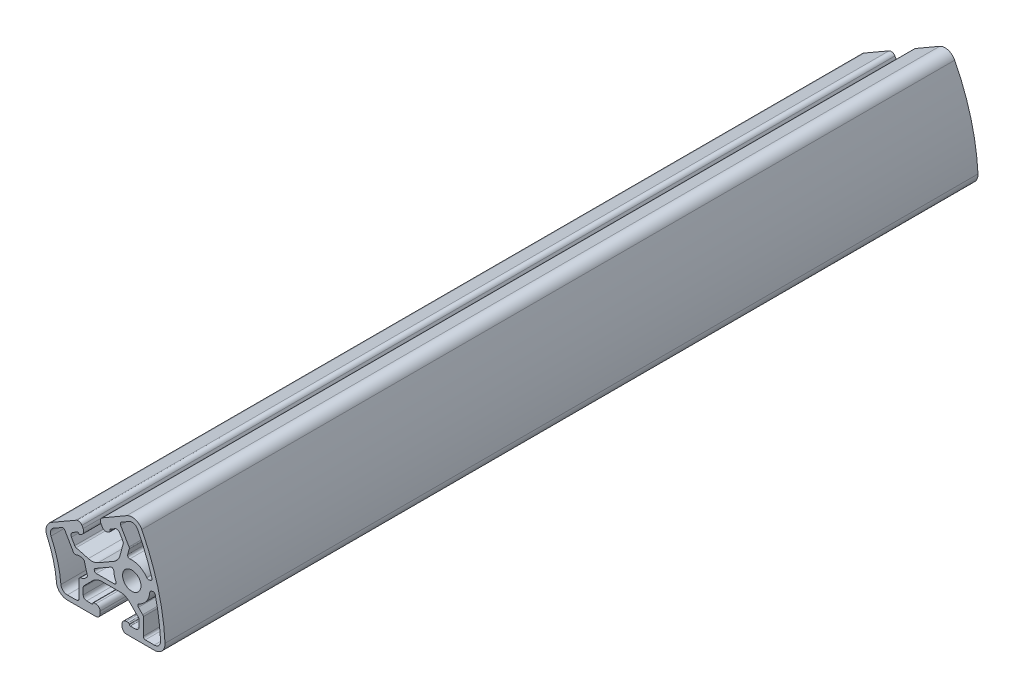
from build123d import *

# Parameters (mm, degrees)
SKETCH1_R      = 3.399999999
EXTRUDE1_DEPTH = 300


with BuildPart() as part:
    # Sketch1 → Extrude1 (new body)
    with BuildSketch(Plane.XY):
        with BuildLine():
            Line((-2.059593866, -18.104416256), (8.279174121, -18.104416256))
            ThreePointArc((8.279174121, -18.104416256), (11.181313383, -16.857158108), (12.273594224, -13.893210106))
            ThreePointArc((12.273594224, -13.893210106), (9.65925826, 2.588190449), (3.682639337, 18.16867))
            ThreePointArc((3.682639337, 18.16867), (1.25472238, 20.189383847), (-1.882233023, 19.818471458))
            Line((-1.882233023, 19.818471458), (-10.835868733, 14.649087471))
            ThreePointArc((-10.835868733, 14.649087471), (-11.517306455, 13.688428826), (-11.352775107, 12.522173349))
            Line((-11.352775107, 12.522173349), (-10.895632574, 11.730379256))
            ThreePointArc((-10.895632574, 11.730379256), (-9.971755302, 11.005610738), (-8.804122697, 11.130000122))
            Line((-8.804122697, 11.130000122), (-8.137309536, 11.51498488))
            ThreePointArc((-8.137309536, 11.51498488), (-7.962051999, 11.739304298), (-7.991807639, 12.022410299))
            Line((-7.991807639, 12.022410299), (-8.005205154, 12.04760736))
            ThreePointArc((-8.005205154, 12.04760736), (-8.034960793, 12.33071336), (-7.859703256, 12.555032779))
            Line((-7.859703256, 12.555032779), (-6.204847981, 13.510463917))
            ThreePointArc((-6.204847981, 13.510463917), (-5.241268241, 13.637321596), (-4.470212547, 13.045669753))
            Line((-4.470212547, 13.045669753), (-3.250166277, 10.932487626))
            ThreePointArc((-3.250166277, 10.932487626), (-3.138682315, 10.604066463), (-3.161365902, 10.257981807))
            Line((-3.161365902, 10.257981807), (-4.364267951, 5.768690249))
            ThreePointArc((-4.364267951, 5.768690249), (-5.183850297, 4.106741659), (-6.577045843, 2.884941957))
            Line((-6.577045843, 2.884941957), (-12.432727244, -0.495837277))
            ThreePointArc((-12.432727244, -0.495837277), (-14.187434599, -1.091480161), (-16.036515473, -0.970284996))
            Line((-16.036515473, -0.970284996), (-20.52580703, 0.232617053))
            ThreePointArc((-20.52580703, 0.232617053), (-20.836866927, 0.386014818), (-21.065546016, 0.646773342))
            Line((-21.065546016, 0.646773342), (-22.285592286, 2.75995547))
            ThreePointArc((-22.285592286, 2.75995547), (-22.412449965, 3.72353521), (-21.820798122, 4.494590904))
            Line((-21.820798122, 4.494590904), (-20.165942847, 5.450022043))
            ThreePointArc((-20.165942847, 5.450022043), (-19.884047763, 5.489639813), (-19.653748594, 5.322317672))
            Line((-19.653748594, 5.322317672), (-19.638626056, 5.298116553))
            ThreePointArc((-19.638626056, 5.298116553), (-19.408326887, 5.130794413), (-19.126431804, 5.170412183))
            Line((-19.126431804, 5.170412183), (-18.514604376, 5.523650914))
            ThreePointArc((-18.514604376, 5.523650914), (-17.78095609, 6.479759973), (-17.938259613, 7.674598851))
            Line((-17.938259613, 7.674598851), (-18.39540247, 8.466393505))
            ThreePointArc((-18.39540247, 8.466393505), (-19.35151153, 9.200041791), (-20.546350407, 9.042738268))
            Line((-20.546350407, 9.042738268), (-29.662040307, 3.779792251))
            ThreePointArc((-29.662040307, 3.779792251), (-31.47445664, 1.526261453), (-31.294110083, -1.360038798))
            ThreePointArc((-31.294110083, -1.360038798), (-28.977774789, -7.764571351), (-27.781513715, -14.469226888))
            ThreePointArc((-27.781513715, -14.469226888), (-26.49454829, -17.059009504), (-23.798184307, -18.104416256))
            Line((-23.798184307, -18.104416256), (-13.272292278, -18.104416256))
            ThreePointArc((-13.272292278, -18.104416256), (-12.158879696, -17.643225664), (-11.697689104, -16.529813082))
            Line((-11.697689104, -16.529813082), (-11.697689104, -15.615527367))
            ThreePointArc((-11.697689104, -15.615527367), (-12.158879696, -14.502114785), (-13.272292278, -14.040924193))
            Line((-13.272292278, -14.040924193), (-13.978769739, -14.040924193))
            ThreePointArc((-13.978769739, -14.040924193), (-14.242706928, -14.147561739), (-14.358490788, -14.407616548))
            Line((-14.358490788, -14.407616548), (-14.35948673, -14.4361366))
            ThreePointArc((-14.35948673, -14.4361366), (-14.475270591, -14.696191409), (-14.739207779, -14.802828955))
            Line((-14.739207779, -14.802828955), (-16.650070056, -14.802828955))
            ThreePointArc((-16.650070056, -14.802828955), (-17.547983429, -14.430901058), (-17.919911326, -13.532987685))
            Line((-17.919911326, -13.532987685), (-17.919911326, -11.092895145))
            ThreePointArc((-17.919911326, -11.092895145), (-17.852248688, -10.752732094), (-17.659561798, -10.464355784))
            Line((-17.659561798, -10.464355784), (-14.373172288, -7.177966273))
            ThreePointArc((-14.373172288, -7.177966273), (-12.83241886, -6.148467746), (-11.014976273, -5.786955939))
            Line((-11.014976273, -5.786955939), (-4.253417808, -5.786955939))
            ThreePointArc((-4.253417808, -5.786955939), (-2.435975221, -6.148467746), (-0.895221793, -7.177966273))
            Line((-0.895221793, -7.177966273), (2.391167718, -10.464355784))
            ThreePointArc((2.391167718, -10.464355784), (2.583854608, -10.752732094), (2.651517245, -11.092895145))
            Line((2.651517245, -11.092895145), (2.651517245, -13.532987685))
            ThreePointArc((2.651517245, -13.532987685), (2.279589349, -14.430901058), (1.381675976, -14.802828955))
            Line((1.381675976, -14.802828955), (-0.529186301, -14.802828955))
            ThreePointArc((-0.529186301, -14.802828955), (-0.79312349, -14.696191409), (-0.90890735, -14.4361366))
            Line((-0.90890735, -14.4361366), (-0.909903292, -14.407616548))
            ThreePointArc((-0.909903292, -14.407616548), (-1.025687153, -14.147561739), (-1.289624342, -14.040924193))
            Line((-1.289624342, -14.040924193), (-2.059593866, -14.040924193))
            ThreePointArc((-2.059593866, -14.040924193), (-3.132988051, -14.517016132), (-3.570704977, -15.606622714))
            Line((-3.570704977, -15.606622714), (-3.570704977, -16.520908428))
            ThreePointArc((-3.570704977, -16.520908428), (-3.130065344, -17.61318056), (-2.059593866, -18.104416256))
        make_face()
        with Locations((3.2e-08, -5.5e-08)):
            Circle(SKETCH1_R, mode=Mode.SUBTRACT)
        with BuildLine():
            Line((-17.471996997, -2.585491548), (-16.423939067, -6.496897212))
            ThreePointArc((-16.423939067, -6.496897212), (-16.409679865, -6.826087675), (-16.53608811, -7.130374779))
            ThreePointArc((-16.53608811, -7.130374779), (-17.543650961, -8.076355418), (-18.844475383, -8.543172397))
            ThreePointArc((-18.844475383, -8.543172397), (-19.312155652, -8.797217087), (-19.498513244, -9.29574932))
            Line((-19.498513244, -9.29574932), (-19.498513244, -15.662799546))
            ThreePointArc((-19.498513244, -15.662799546), (-19.718246677, -16.197319926), (-20.250387025, -16.4227561))
            Line((-20.250387025, -16.4227561), (-23.778549311, -16.460482754))
            ThreePointArc((-23.778549311, -16.460482754), (-25.37859993, -15.854783364), (-26.143910087, -14.324641508))
            ThreePointArc((-26.143910087, -14.324641508), (-27.389825963, -7.33908176), (-29.803611037, -0.666451621))
            ThreePointArc((-29.803611037, -0.666451621), (-29.905903927, 1.041345175), (-28.823069139, 2.365921544))
            Line((-28.823069139, 2.365921544), (-25.748727644, 4.097330446))
            ThreePointArc((-25.748727644, 4.097330446), (-25.175162497, 4.168167167), (-24.717607571, 3.815125655))
            Line((-24.717607571, 3.815125655), (-21.534082474, -1.698901561))
            ThreePointArc((-21.534082474, -1.698901561), (-21.123425948, -2.037464343), (-20.591380608, -2.023633363))
            ThreePointArc((-20.591380608, -2.023633363), (-19.231425073, -1.777496514), (-17.885859686, -2.092958393))
            ThreePointArc((-17.885859686, -2.092958393), (-17.624243388, -2.293274639), (-17.471996997, -2.585491548))
        make_face(mode=Mode.SUBTRACT)
        with BuildLine():
            Line((7.190897434, 0.242092847), (7.722900865, 0.38464274))
            ThreePointArc((7.722900865, 0.38464274), (8.309684208, 0.302794353), (8.659411124, -0.175436695))
            ThreePointArc((8.659411124, -0.175436695), (9.953652351, -7.035721769), (10.632131313, -13.983976078))
            ThreePointArc((10.632131313, -13.983976078), (9.981645181, -15.73436744), (8.260122506, -16.457804934))
            Line((8.260122506, -16.457804934), (5.002311314, -16.422756139))
            ThreePointArc((5.002311314, -16.422756139), (4.47017203, -16.197320416), (4.250439036, -15.662801104))
            Line((4.250439036, -15.662801104), (4.250439036, -9.395167615))
            ThreePointArc((4.250439036, -9.395167615), (4.192587481, -9.104328206), (4.02784019, -8.857766461))
            Line((4.02784019, -8.857766461), (2.472174548, -7.302100819))
            ThreePointArc((2.472174548, -7.302100819), (2.262321312, -6.626096356), (2.700649697, -6.070318845))
            ThreePointArc((2.700649697, -6.070318845), (5.448190239, -3.80256528), (6.629279814, -0.441507013))
            ThreePointArc((6.629279814, -0.441507013), (6.800365527, -0.009563085), (7.190897434, 0.242092847))
        make_face(mode=Mode.SUBTRACT)
        with BuildLine():
            Line((-1.510084411, 7.559891942), (-0.940671266, 9.684970729))
            ThreePointArc((-0.940671266, 9.684970729), (-0.921276799, 9.980873109), (-1.016595587, 10.261673203))
            Line((-1.016595587, 10.261673203), (-4.150412332, 15.689603027))
            ThreePointArc((-4.150412332, 15.689603027), (-4.227383934, 16.262352796), (-3.879292116, 16.723654228))
            Line((-3.879292116, 16.723654228), (-1.075426501, 18.382938276))
            ThreePointArc((-1.075426501, 18.382938276), (0.77717457, 18.617184399), (2.215707781, 17.426544162))
            ThreePointArc((2.215707781, 17.426544162), (5.102254892, 11.069940004), (7.411551633, 4.48163831))
            ThreePointArc((7.411551633, 4.48163831), (7.347794829, 3.892614543), (6.8805497, 3.528340035))
            Line((6.8805497, 3.528340035), (6.348546228, 3.385790132))
            ThreePointArc((6.348546228, 3.385790132), (5.884507712, 3.408464604), (5.520371172, 3.696996155))
            ThreePointArc((5.520371172, 3.696996155), (2.816988485, 6.017213134), (-0.69632814, 6.607375035))
            ThreePointArc((-0.69632814, 6.607375035), (-1.353820412, 6.869528286), (-1.510084411, 7.559891942))
        make_face(mode=Mode.SUBTRACT)
        with BuildLine():
            Line((-6.519522932, -4.269206071), (-13.09653484, -4.269206071))
            ThreePointArc((-13.09653484, -4.269206071), (-13.830638522, -3.705908495), (-13.476534864, -2.851026646))
            Line((-13.476534864, -2.851026646), (-7.780675483, 0.437479301))
            ThreePointArc((-7.780675483, 0.437479301), (-7.030528407, 0.443070393), (-6.641013202, -0.198045665))
            ThreePointArc((-6.641013202, -0.198045665), (-6.417577923, -1.719584898), (-5.850308929, -3.148994163))
            ThreePointArc((-5.850308929, -3.148994163), (-5.867080961, -3.89897456), (-6.519522932, -4.269206071))
        make_face(mode=Mode.SUBTRACT)
    extrude(amount=-EXTRUDE1_DEPTH)


solid = part.part
